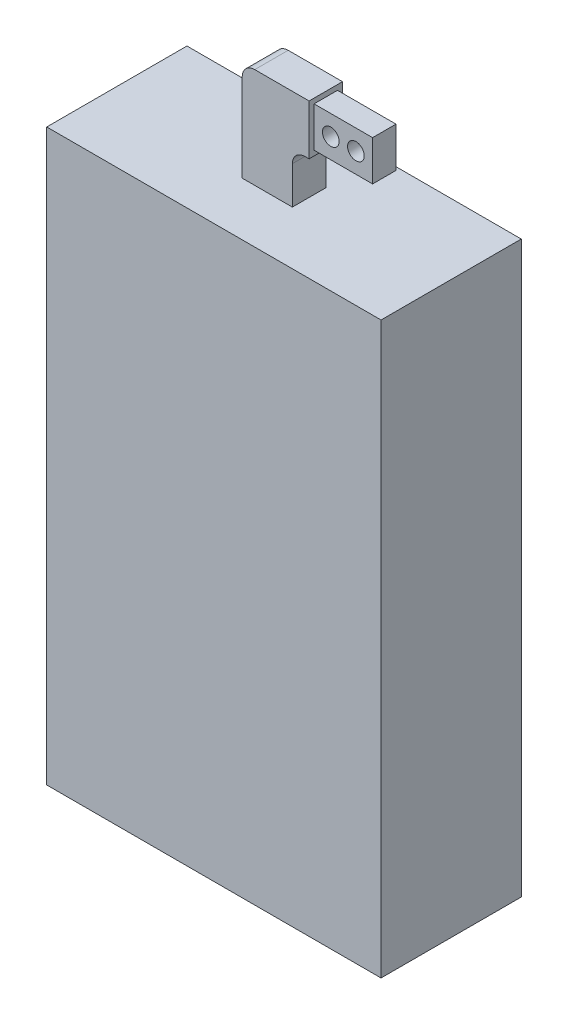
from build123d import *

# Parameters (mm, degrees)
SKETCH1_W                  = 200
SKETCH1_H                  = 83.89
WHEEL_STEERING_DUMMY_DEPTH = 340.92
MOUNT_BODY_DEPTH           = 10
MOUNT_BODY_DEPTH_BACK      = 10
SKETCH3_W                  = 20
SKETCH3_H                  = 30
SKETCH3_W_2                = 14
SKETCH3_H_2                = 24
MOUNT_TONGUE_DEPTH         = 35
SKETCH4_R                  = 5
MOUNT_BOLT_HOLES_DEPTH     = 359.639177203
FILLET1_R                  = 7.5


with BuildPart() as part:
    # Sketch1 → Wheel & Steering Dummy (new body)
    with BuildSketch(Plane(origin=(0, 0, 0), x_dir=(1, 0, 0), z_dir=(0, 1, 0))):
        Rectangle(SKETCH1_W, SKETCH1_H)
    extrude(amount=-WHEEL_STEERING_DUMMY_DEPTH)

    # Sketch2 → Mount Body (add, two sides: drawn at the far end of the back side and taken through both)
    with BuildSketch(Plane.XY.offset(-MOUNT_BODY_DEPTH_BACK)):
        Polygon((-15, 0), (15, 0), (15, 30), (60, 30), (60, 60), (15, 60), (-15, 60), align=None)
    extrude(amount=MOUNT_BODY_DEPTH + MOUNT_BODY_DEPTH_BACK)

    # Sketch3 → Mount Tongue (cut)
    with BuildSketch(Plane(origin=(60, 0, 0), x_dir=(0, 0, -1), z_dir=(1, 0, 0))):
        with Locations((0, 45)):
            Rectangle(SKETCH3_W, SKETCH3_H)
        with Locations((0, 45)):
            Rectangle(SKETCH3_W_2, SKETCH3_H_2, mode=Mode.SUBTRACT)
    extrude(amount=-MOUNT_TONGUE_DEPTH, mode=Mode.SUBTRACT)

    # Sketch4 → Mount Bolt Holes (cut, through all)
    with BuildSketch(Plane.XY.offset(7)):
        with Locations((35, 45)):
            Circle(SKETCH4_R)
        with Locations((50, 45)):
            Circle(SKETCH4_R)
    extrude(amount=-MOUNT_BOLT_HOLES_DEPTH, mode=Mode.SUBTRACT)

    # Fillet1
    fillet1_edges = [part.edges().sort_by_distance(p)[0] for p in [
        (-15, 60, 0),
        (15, 30, 0),
    ]]
    fillet(fillet1_edges, radius=FILLET1_R)


solid = part.part
